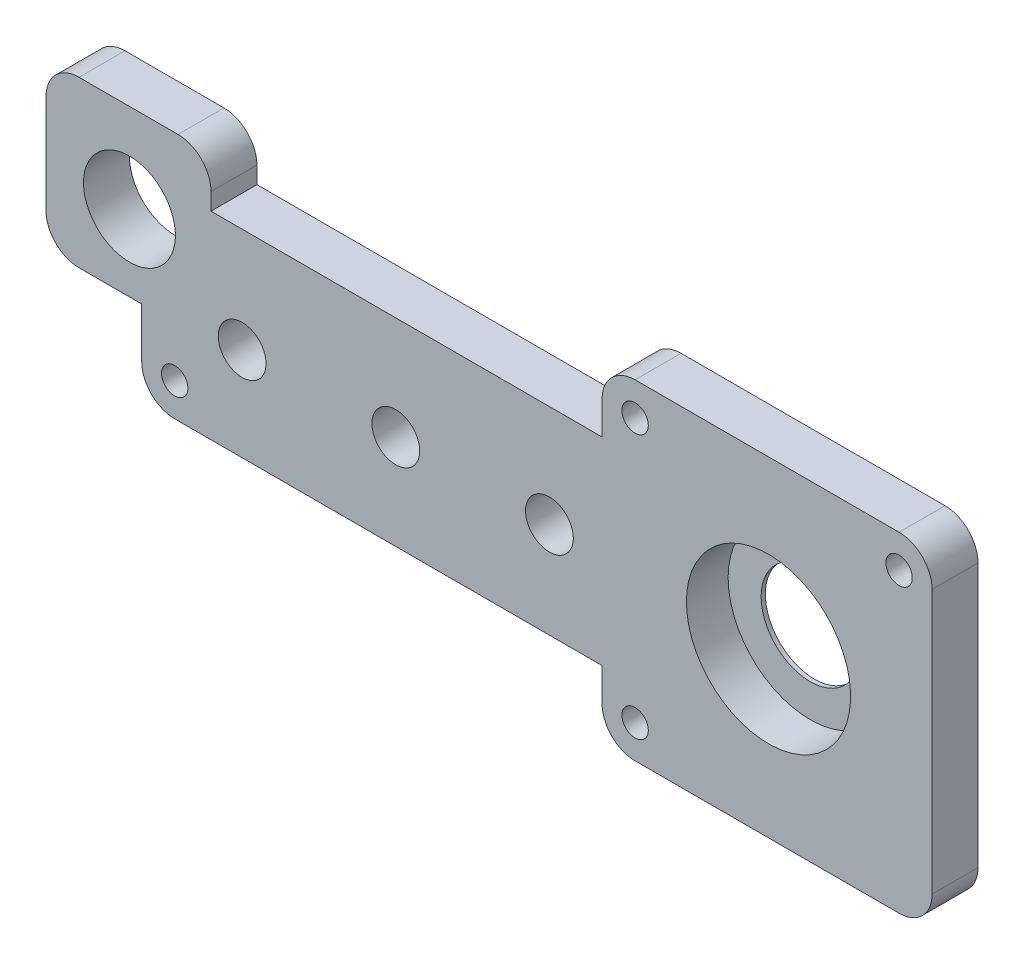
from build123d import *

# Parameters (mm, degrees)
SKETCH4_R                = 4.7244
STOCK_DEPTH              = 4.4196
SKETCH7_R                = 7.8994
CV_GEAR_WELL_DEPTH       = 4.0132
SKETCH8_R                = 2.2987
IDLER_GEAR_WELL_DEPTH    = 4.2926
SKETCH9_R                = 1.27
SKETCH9_R_2              = 4.4196
OUTDRIVE_GEAR_WELL_DEPTH = 4.4196


with BuildPart() as part:
    # Sketch4 → Stock (new body)
    with BuildSketch(Plane.XY):
        with BuildLine():
            Line((-32.450767839, 9.202272933), (-41.975767839, 9.202272933))
            ThreePointArc((-41.975767839, 9.202272933), (-44.220831869, 8.272336964), (-45.150767839, 6.027272933))
            Line((-45.150767839, 6.027272933), (-45.150767839, -3.497727067))
            ThreePointArc((-45.150767839, -3.497727067), (-44.220831869, -5.742791097), (-41.975767839, -6.672727067))
            Line((-41.975767839, -6.672727067), (-35.942804696, -6.672727067))
            Line((-35.942804696, -6.672727067), (-35.942804696, -11.480556714))
            ThreePointArc((-35.942804696, -11.480556714), (-35.012868726, -13.725620744), (-32.767804696, -14.655556714))
            Line((-32.767804696, -14.655556714), (8.354795304, -14.655556714))
            Line((8.354795304, -14.655556714), (8.354795304, -17.830556714))
            ThreePointArc((8.354795304, -17.830556714), (9.284731274, -20.075620744), (11.529795304, -21.005556714))
            Line((11.529795304, -21.005556714), (36.929795304, -21.005556714))
            ThreePointArc((36.929795304, -21.005556714), (39.174859334, -20.075620744), (40.104795304, -17.830556714))
            Line((40.104795304, -17.830556714), (40.104795304, 7.569443286))
            ThreePointArc((40.104795304, 7.569443286), (39.174859334, 9.814507317), (36.929795304, 10.744443286))
            Line((36.929795304, 10.744443286), (11.529795304, 10.744443286))
            ThreePointArc((11.529795304, 10.744443286), (9.284731274, 9.814507317), (8.354795304, 7.569443286))
            Line((8.354795304, 7.569443286), (8.354795304, 4.394443286))
            Line((8.354795304, 4.394443286), (-29.275767839, 4.394443286))
            Line((-29.275767839, 4.394443286), (-29.275767839, 6.027272933))
            ThreePointArc((-29.275767839, 6.027272933), (-30.205703809, 8.272336964), (-32.450767839, 9.202272933))
        make_face()
        with Locations((24.367264728, -5.266950247)):
            Circle(SKETCH4_R, mode=Mode.SUBTRACT)
    extrude(amount=-STOCK_DEPTH)

    # Sketch7 → CV Gear Well (cut)
    with BuildSketch(Plane(origin=(0, 0, 0), x_dir=(-1, 0, 0), z_dir=(0, 0, -1))):
        with Locations((-24.367264728, -5.266950247)):
            Circle(SKETCH7_R)
    extrude(amount=CV_GEAR_WELL_DEPTH, mode=Mode.SUBTRACT)

    # Sketch8 → Idler Gear Well (cut)
    with BuildSketch(Plane(origin=(0, 0, 0), x_dir=(-1, 0, 0), z_dir=(0, 0, -1))):
        with Locations((26.278771935, -5.664889979)):
            Circle(SKETCH8_R)
        with Locations((11.496428235, -5.54874107)):
            Circle(SKETCH8_R)
        with Locations((-3.285915465, -5.432592161)):
            Circle(SKETCH8_R)
    extrude(amount=IDLER_GEAR_WELL_DEPTH, mode=Mode.SUBTRACT)

    # Sketch9 → Outdrive Gear Well (cut)
    with BuildSketch(Plane(origin=(0, 0, 0), x_dir=(-1, 0, 0), z_dir=(0, 0, -1))):
        with Locations((32.767804696, -11.480556714)):
            Circle(SKETCH9_R)
        with Locations((-11.529795304, -17.830556714)):
            Circle(SKETCH9_R)
        with Locations((-11.529795304, 7.569443286)):
            Circle(SKETCH9_R)
        with Locations((-36.929795304, 7.569443286)):
            Circle(SKETCH9_R)
        with Locations((37.124150155, 0.645421982)):
            Circle(SKETCH9_R_2)
    extrude(amount=OUTDRIVE_GEAR_WELL_DEPTH, mode=Mode.SUBTRACT)


solid = part.part
